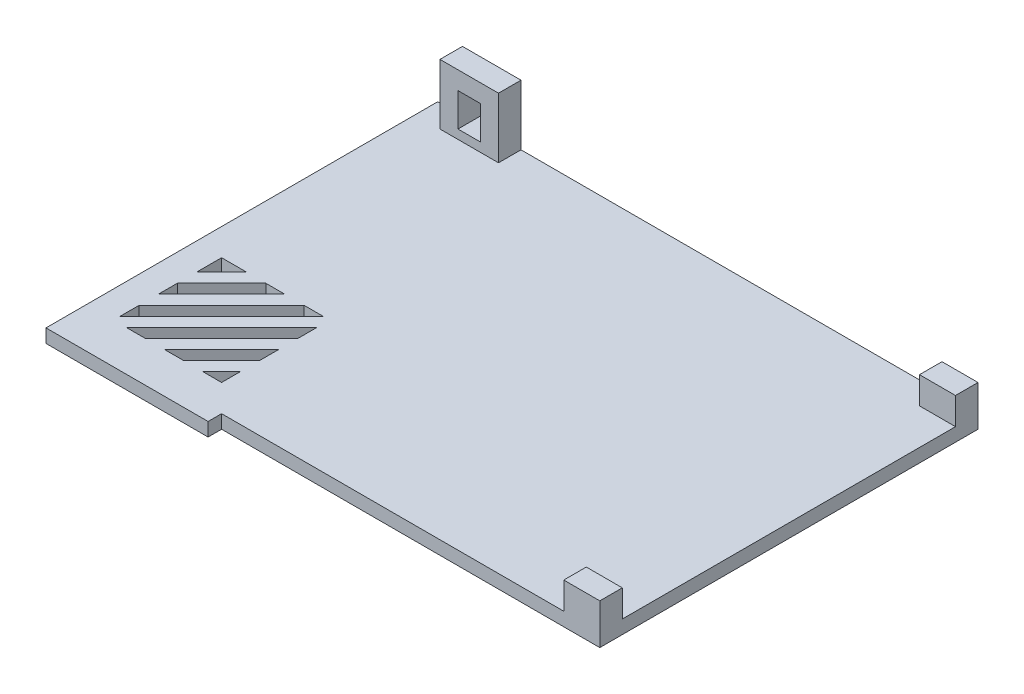
from build123d import *

# Parameters (mm, degrees)
SKETCH_1_W          = 60
SKETCH_1_H          = 42
EXTRUDE_1_DEPTH     = 1.5
SKETCH_2_W          = 18
SKETCH_2_H          = 1.5
EXTRUDE_2_DEPTH     = 1.5
SKETCH_3_W          = 12
SKETCH_3_H          = 12
CUT_EXTRUDE_1_DEPTH = 74.254692682
EXTRUDE_1_2_DEPTH   = 1.5
SKETCH_5_W          = 6.5
SKETCH_5_H          = 6.698076211
SKETCH_5_W_2        = 2.5
SKETCH_5_H_2        = 3.698076211
EXTRUDE_3_DEPTH     = 2.5
SKETCH_7_W          = 4
SKETCH_7_H          = 2.5
EXTRUDE_4_DEPTH     = 3


with BuildPart() as part:
    # Эскиз1 → Extrude 1 (new body)
    with BuildSketch(Plane(origin=(0, 0, 0), x_dir=(1, 0, 0), z_dir=(0, 1, 0))):
        with Locations((-30, 21)):
            Rectangle(SKETCH_1_W, SKETCH_1_H)
    extrude(amount=EXTRUDE_1_DEPTH)

    # Эскиз2 → Бобышка-Вытянуть2 (add, through all)
    with BuildSketch(Plane(origin=(0, 0, 0), x_dir=(1, 0, 0), z_dir=(0, 1, 0))):
        with Locations((-51, -0.75)):
            Rectangle(SKETCH_2_W, SKETCH_2_H)
    extrude(amount=EXTRUDE_2_DEPTH)

    # Эскиз3 → Вырез-Вытянуть1 (cut, through all)
    with BuildSketch(Plane(origin=(0, 0, 0), x_dir=(1, 0, 0), z_dir=(0, 1, 0))):
        with Locations((-51, 9)):
            Rectangle(SKETCH_3_W, SKETCH_3_H)
    extrude(amount=CUT_EXTRUDE_1_DEPTH, mode=Mode.SUBTRACT)

    # Эскиз4 → Extrude 1 2 (add, through all)
    with BuildSketch(Plane(origin=(0, 0, 0), x_dir=(1, 0, 0), z_dir=(0, 1, 0))):
        Polygon((-51.242640687, 1), (-43, 9.242640687), (-41.939339828, 8.181980515), (-50.181980515, -0.060660172), align=None)
        Polygon((-55.485281374, 1), (-43, 13.485281374), (-41.939339828, 12.424621202), (-54.424621202, -0.060660172), align=None)
        Polygon((-59, 1.727922061), (-43, 17.727922061), (-41.939339828, 16.66726189), (-57.939339828, 0.66726189), align=None)
        Polygon((-59, 5.970562748), (-43, 21.970562748), (-41.939339828, 20.909902577), (-57.939339828, 4.909902577), align=None)
        Polygon((-59, 10.213203436), (-52.213203436, 17), (-51.152543264, 15.939339828), (-57.939339828, 9.152543264), align=None)
    extrude(amount=EXTRUDE_1_2_DEPTH)

    # Эскиз5 → Бобышка-Вытянуть3 (add)
    with BuildSketch(Plane(origin=(0, 0, -42), x_dir=(-1, 0, 0), z_dir=(0, 0, -1))):
        with Locations((54, 4.849038106)):
            Rectangle(SKETCH_5_W, SKETCH_5_H)
        with Locations((54, 4.349038106)):
            Rectangle(SKETCH_5_W_2, SKETCH_5_H_2, mode=Mode.SUBTRACT)
    extrude(amount=-EXTRUDE_3_DEPTH)

    # Эскиз7 → Бобышка-Вытянуть4 (add)
    with BuildSketch(Plane(origin=(0, 1.5, 0), x_dir=(1, 0, 0), z_dir=(0, 1, 0))):
        with Locations((-2, 1.25)):
            Rectangle(SKETCH_7_W, SKETCH_7_H)
        with Locations((-2, 40.75)):
            Rectangle(SKETCH_7_W, SKETCH_7_H)
    extrude(amount=EXTRUDE_4_DEPTH)


solid = part.part
